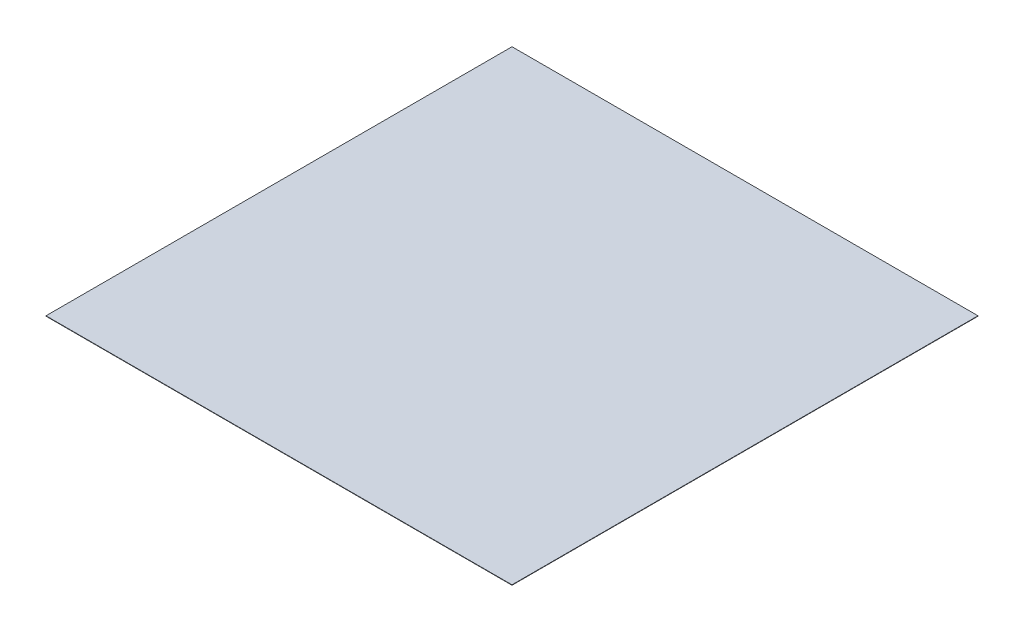
from build123d import *

# Parameters (mm, degrees)
BOSS_EXTRUDE1_DEPTH = 20
BOSS_EXTRUDE2_START = -5
SKETCH3_W           = 26.197224363
SKETCH3_H           = 40
SKETCH3_R           = 1.5
SKETCH3_W_2         = 30.197224362
BOSS_EXTRUDE2_DEPTH = 5
SKETCH4_W           = 1200
SKETCH4_H           = 1200
BOSS_EXTRUDE3_DEPTH = 1
SKETCH5_R           = 1.5
BOSS_EXTRUDE4_DEPTH = 13.5


with BuildPart() as part:
    # Sketch2 → Boss-Extrude1 (new body)
    with BuildSketch(Plane(origin=(0, 0, 134.88320255), x_dir=(-1, 0, 0), z_dir=(0, 0, -1))):
        with BuildLine():
            Line((-8.010113394, 167.06443927), (-27.207337757, 167.06443927))
            ThreePointArc((-27.207337757, 167.06443927), (-25.963827563, 165.787849446), (-25.510113394, 164.06443927))
            Line((-25.510113394, 164.06443927), (-25.510113394, 160.06443927))
            ThreePointArc((-25.510113394, 160.06443927), (-24.777880347, 158.296672317), (-23.010113394, 157.56443927))
            Line((-23.010113394, 157.56443927), (-19.010113394, 157.56443927))
            ThreePointArc((-19.010113394, 157.56443927), (-16.53523966, 156.539313005), (-15.510113394, 154.06443927))
            Line((-15.510113394, 154.06443927), (-15.510113394, 120.06443927))
            ThreePointArc((-15.510113394, 120.06443927), (-16.53523966, 117.589565536), (-19.010113394, 116.56443927))
            Line((-19.010113394, 116.56443927), (-23.010113394, 116.56443927))
            ThreePointArc((-23.010113394, 116.56443927), (-24.777880347, 115.832206223), (-25.510113394, 114.06443927))
            Line((-25.510113394, 114.06443927), (-25.510113394, 110.06443927))
            ThreePointArc((-25.510113394, 110.06443927), (-26.53523966, 107.589565536), (-29.010113394, 106.56443927))
            Line((-29.010113394, 106.56443927), (-63.010113394, 106.56443927))
            ThreePointArc((-63.010113394, 106.56443927), (-65.484987129, 107.589565536), (-66.510113394, 110.06443927))
            Line((-66.510113394, 110.06443927), (-66.510113394, 114.06443927))
            ThreePointArc((-66.510113394, 114.06443927), (-67.242346441, 115.832206223), (-69.010113394, 116.56443927))
            Line((-69.010113394, 116.56443927), (-73.010113394, 116.56443927))
            ThreePointArc((-73.010113394, 116.56443927), (-75.484987129, 117.589565536), (-76.510113394, 120.06443927))
            Line((-76.510113394, 120.06443927), (-76.510113394, 154.06443927))
            ThreePointArc((-76.510113394, 154.06443927), (-75.484987129, 156.539313005), (-73.010113394, 157.56443927))
            Line((-73.010113394, 157.56443927), (-69.010113394, 157.56443927))
            ThreePointArc((-69.010113394, 157.56443927), (-67.242346441, 158.296672317), (-66.510113394, 160.06443927))
            Line((-66.510113394, 160.06443927), (-66.510113394, 164.06443927))
            ThreePointArc((-66.510113394, 164.06443927), (-66.056399226, 165.787849446), (-64.812889032, 167.06443927))
            Line((-64.812889032, 167.06443927), (-84.010113394, 167.06443927))
            Line((-84.010113394, 167.06443927), (-84.010113394, 154.06443927))
            Line((-84.010113394, 154.06443927), (-84.010113394, 120.06443927))
            ThreePointArc((-84.010113394, 120.06443927), (-81.119985899, 112.63275252), (-73.968301038, 109.106251627))
            ThreePointArc((-73.968301038, 109.106251627), (-70.441800145, 101.954566766), (-63.010113394, 99.06443927))
            Line((-63.010113394, 99.06443927), (-29.010113394, 99.06443927))
            ThreePointArc((-29.010113394, 99.06443927), (-21.578426644, 101.954566766), (-18.051925751, 109.106251627))
            ThreePointArc((-18.051925751, 109.106251627), (-10.90024089, 112.63275252), (-8.010113394, 120.06443927))
            Line((-8.010113394, 120.06443927), (-8.010113394, 154.06443927))
            Line((-8.010113394, 154.06443927), (-8.010113394, 167.06443927))
        make_face()
    extrude(amount=BOSS_EXTRUDE1_DEPTH)

    # Sketch3 → Boss-Extrude2 (add)
    # profile 1 of 2: a face of its own
    with BuildSketch(Plane(origin=(0, 167.06443927, 0), x_dir=(1, 0, 0), z_dir=(0, 1, 0)).offset(BOSS_EXTRUDE2_START)):
        with Locations((11.108725576, -124.88320255)):
            Rectangle(SKETCH3_W, SKETCH3_H)
        with Locations(Location((3.010113394, -139.88320255, 0), (0, 0, 270))):
            Circle(SKETCH3_R, mode=Mode.SUBTRACT)
        with Locations(Location((3.010113394, -109.88320255, 0), (0, 0, 90))):
            Circle(SKETCH3_R, mode=Mode.SUBTRACT)
    # profile 2 of 2: a face of its own
    with BuildSketch(Plane(origin=(0, 167.06443927, 0), x_dir=(1, 0, 0), z_dir=(0, 1, 0)).offset(BOSS_EXTRUDE2_START)):
        with Locations((82.911501213, -124.88320255)):
            Rectangle(SKETCH3_W_2, SKETCH3_H)
        with Locations(Location((93.010113394, -109.88320255, 0), (0, 0, 270))):
            Circle(SKETCH3_R, mode=Mode.SUBTRACT)
        with Locations(Location((93.010113394, -139.88320255, 0), (0, 0, 90))):
            Circle(SKETCH3_R, mode=Mode.SUBTRACT)
    extrude(amount=BOSS_EXTRUDE2_DEPTH)

    # Sketch5 → Boss-Extrude4 (add)
    with BuildSketch(Plane(origin=(0, 167.06443927, 0), x_dir=(1, 0, 0), z_dir=(0, 1, 0))):
        Polygon((98.010113394, -144.88320255), (98.010113394, -104.88320255), (67.812889032, -104.88320255), (24.207337757, -104.88320255), (-1.989886606, -104.88320255), (-1.989886606, -144.88320255), (24.207337757, -144.88320255), (67.812889032, -144.88320255), align=None)
        with Locations(Location((93.010113394, -139.88320255, 0), (0, 0, 90))):
            Circle(SKETCH5_R, mode=Mode.SUBTRACT)
        with Locations(Location((93.010113394, -109.88320255, 0), (0, 0, 180))):
            Circle(SKETCH5_R, mode=Mode.SUBTRACT)
        with Locations(Location((3.010113394, -139.88320255, 0), (0, 0, 180))):
            Circle(SKETCH5_R, mode=Mode.SUBTRACT)
        with Locations(Location((3.010113394, -109.88320255, 0), (0, 0, 90))):
            Circle(SKETCH5_R, mode=Mode.SUBTRACT)
    extrude(amount=BOSS_EXTRUDE4_DEPTH)


with BuildPart() as body_2:
    # Sketch4 → Boss-Extrude3 (new body)
    with BuildSketch(Plane(origin=(0, 237.06443927, 0), x_dir=(1, 0, 0), z_dir=(0, 1, 0))):
        Rectangle(SKETCH4_W, SKETCH4_H)
    extrude(amount=BOSS_EXTRUDE3_DEPTH)


solid = Compound([part.part, body_2.part])
